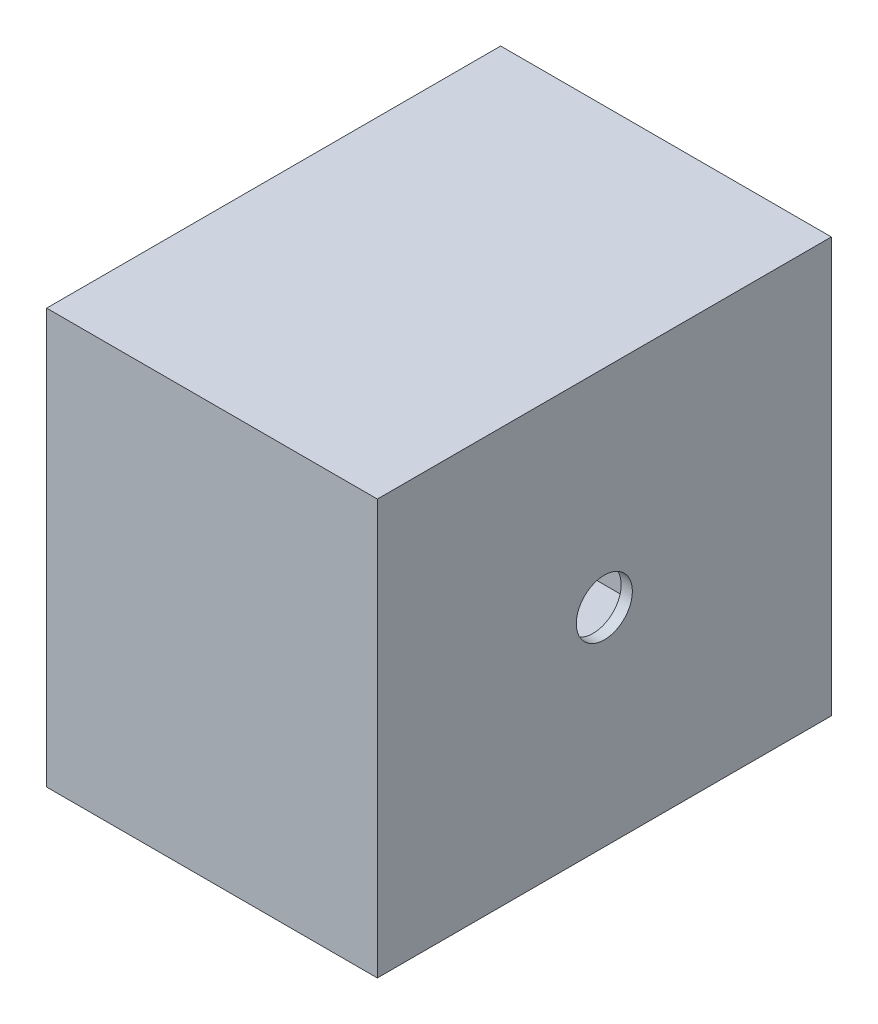
from build123d import *

# Parameters (mm, degrees)
SKETCH1_W           = 81
SKETCH1_H           = 74
BOSS_EXTRUDE1_DEPTH = 59
SKETCH3_R           = 5
CUT_EXTRUDE1_DEPTH  = 160
SKETCH4_W           = 55
SKETCH4_H           = 77
CUT_EXTRUDE2_DEPTH  = 70


with BuildPart() as part:
    # Sketch1 → Boss-Extrude1 (new body)
    with BuildSketch(Plane(origin=(0, 0, 0), x_dir=(0, 0, -1), z_dir=(1, 0, 0))):
        Rectangle(SKETCH1_W, SKETCH1_H)
    extrude(amount=BOSS_EXTRUDE1_DEPTH)

    # Sketch3 → Cut-Extrude1 (cut)
    with BuildSketch(Plane(origin=(0, 0, 0), x_dir=(0, 0, -1), z_dir=(1, 0, 0))):
        Circle(SKETCH3_R)
    extrude(amount=CUT_EXTRUDE1_DEPTH, mode=Mode.SUBTRACT)

    # Sketch4 → Cut-Extrude2 (cut)
    with BuildSketch(Plane(origin=(0, 35, 0), x_dir=(1, 0, 0), z_dir=(0, 1, 0))):
        with Locations((29.5, 0)):
            Rectangle(SKETCH4_W, SKETCH4_H)
    extrude(amount=-CUT_EXTRUDE2_DEPTH, mode=Mode.SUBTRACT)


solid = part.part
